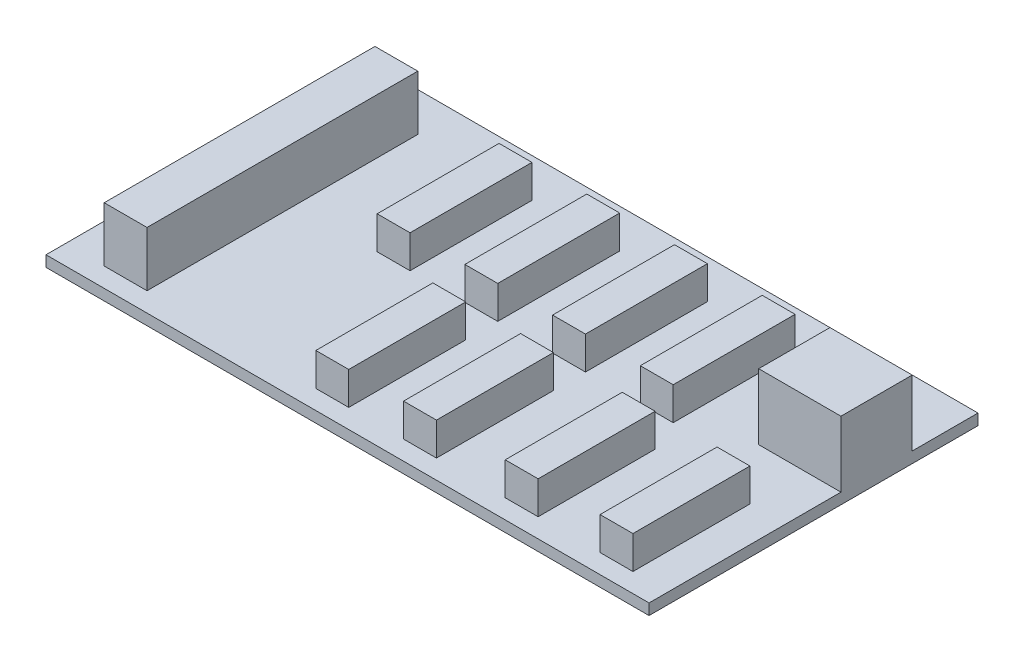
from build123d import *

# Parameters (mm, degrees)
SKETCH1_W           = 110
SKETCH1_H           = 60
BOSS_EXTRUDE1_DEPTH = 2
SKETCH2_W           = 15
SKETCH2_H           = 13
BOSS_EXTRUDE2_DEPTH = 12
SKETCH3_W           = 6
SKETCH3_H           = 22.239539295
SKETCH3_H_2         = 21.340972051
BOSS_EXTRUDE3_DEPTH = 6
SKETCH4_W           = 7.81140843
SKETCH4_H           = 49.385459964
BOSS_EXTRUDE4_DEPTH = 10


with BuildPart() as part:
    # Sketch1 → Boss-Extrude1 (new body)
    with BuildSketch(Plane(origin=(0, 0, 0), x_dir=(1, 0, 0), z_dir=(0, 1, 0))):
        with Locations((3.029999611, 10.181542367)):
            Rectangle(SKETCH1_W, SKETCH1_H)
    extrude(amount=BOSS_EXTRUDE1_DEPTH)

    # Sketch2 → Boss-Extrude2 (add)
    with BuildSketch(Plane(origin=(0, 2, 0), x_dir=(1, 0, 0), z_dir=(0, 1, 0))):
        with Locations((50.529999611, 21.681542367)):
            Rectangle(SKETCH2_W, SKETCH2_H)
    extrude(amount=BOSS_EXTRUDE2_DEPTH)

    # Sketch3 → Boss-Extrude3 (add)
    with BuildSketch(Plane(origin=(0, 2, 0), x_dir=(1, 0, 0), z_dir=(0, 1, 0))):
        with Locations((28.757795867, 21.975237447)):
            Rectangle(SKETCH3_W, SKETCH3_H)
        with Locations((12.757795867, 21.975237447)):
            Rectangle(SKETCH3_W, SKETCH3_H)
        with Locations((-3.242204133, 21.975237447)):
            Rectangle(SKETCH3_W, SKETCH3_H)
        with Locations((-19.242204133, 21.975237447)):
            Rectangle(SKETCH3_W, SKETCH3_H)
        with Locations((48.599622808, -5.655705314)):
            Rectangle(SKETCH3_W, SKETCH3_H_2)
        with Locations((31.302203356, -5.655705314)):
            Rectangle(SKETCH3_W, SKETCH3_H_2)
        with Locations((12.757795867, -5.655705314)):
            Rectangle(SKETCH3_W, SKETCH3_H_2)
        with Locations((-3.242204133, -5.655705314)):
            Rectangle(SKETCH3_W, SKETCH3_H_2)
    extrude(amount=BOSS_EXTRUDE3_DEPTH)

    # Sketch4 → Boss-Extrude4 (add)
    with BuildSketch(Plane(origin=(0, 2, 0), x_dir=(1, 0, 0), z_dir=(0, 1, 0))):
        with Locations((-40.974267879, 8.402277113)):
            Rectangle(SKETCH4_W, SKETCH4_H)
    extrude(amount=BOSS_EXTRUDE4_DEPTH)


solid = part.part
